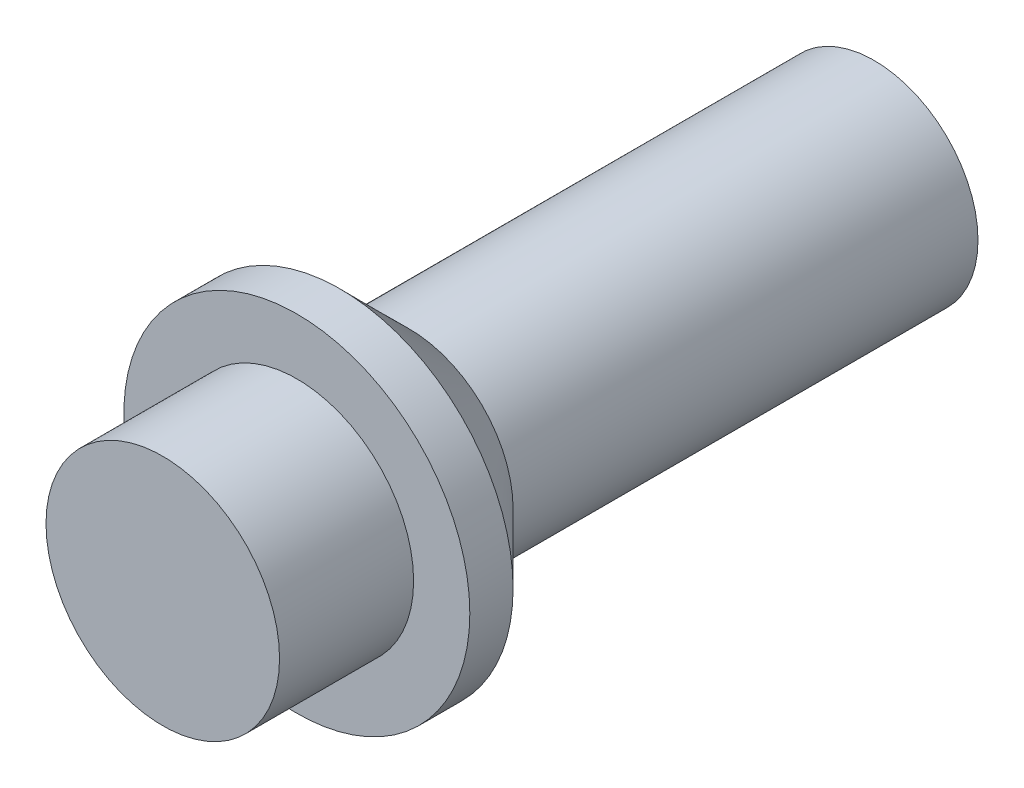
from build123d import *

# Parameters (mm, degrees)
PLUNGER_STEM_START          = 24.25
SKETCH_1_R                  = 2.4
PLUNGER_STEM_DEPTH          = 10.75
PRINTABLE_FLANGE_RAMP_START = 35
SKETCH_2_R                  = 2.4
PRINTABLE_FLANGE_RAMP_DEPTH = 1.6
PRINTABLE_FLANGE_RAMP_DRAFT = -45
CAPTIVE_FLANGE_START        = 36.6
SKETCH_3_R                  = 4
CAPTIVE_FLANGE_DEPTH        = 1
EXPOSED_KEY_CAP_START       = 37.6
SKETCH_4_R                  = 2.7
EXPOSED_KEY_CAP_DEPTH       = 3.1


with BuildPart() as part:
    # 草图1 → Plunger_stem (new body)
    with BuildSketch(Plane.XY.offset(PLUNGER_STEM_START)):
        Circle(SKETCH_1_R)
    extrude(amount=PLUNGER_STEM_DEPTH)


with BuildPart() as printable_flange_ramp_tool:
    # 草图2 → Printable_flange_ramp (with draft: the straight prism first)
    with BuildSketch(Plane.XY.offset(PRINTABLE_FLANGE_RAMP_START)):
        Circle(SKETCH_2_R)
    extrude(amount=PRINTABLE_FLANGE_RAMP_DEPTH)
    # Printable_flange_ramp: the draft: its side faces are tilted about the plane it starts from
    printable_flange_ramp_sides = [printable_flange_ramp_tool.faces().sort_by_distance(p)[0] for p in [
        (-2.4, 0, 35.8),
    ]]
    draft(printable_flange_ramp_sides, Plane.XY.offset(PRINTABLE_FLANGE_RAMP_START), PRINTABLE_FLANGE_RAMP_DRAFT)


with BuildPart() as part_1:
    add(part.part)

    # Printable_flange_ramp: add printable_flange_ramp_tool
    add(printable_flange_ramp_tool.part)

    # 草图3 → Captive_flange (add)
    with BuildSketch(Plane.XY.offset(CAPTIVE_FLANGE_START)):
        Circle(SKETCH_3_R)
    extrude(amount=CAPTIVE_FLANGE_DEPTH)

    # 草图4 → Exposed_key_cap (add)
    with BuildSketch(Plane.XY.offset(EXPOSED_KEY_CAP_START)):
        Circle(SKETCH_4_R)
    extrude(amount=EXPOSED_KEY_CAP_DEPTH)


solid = part_1.part
